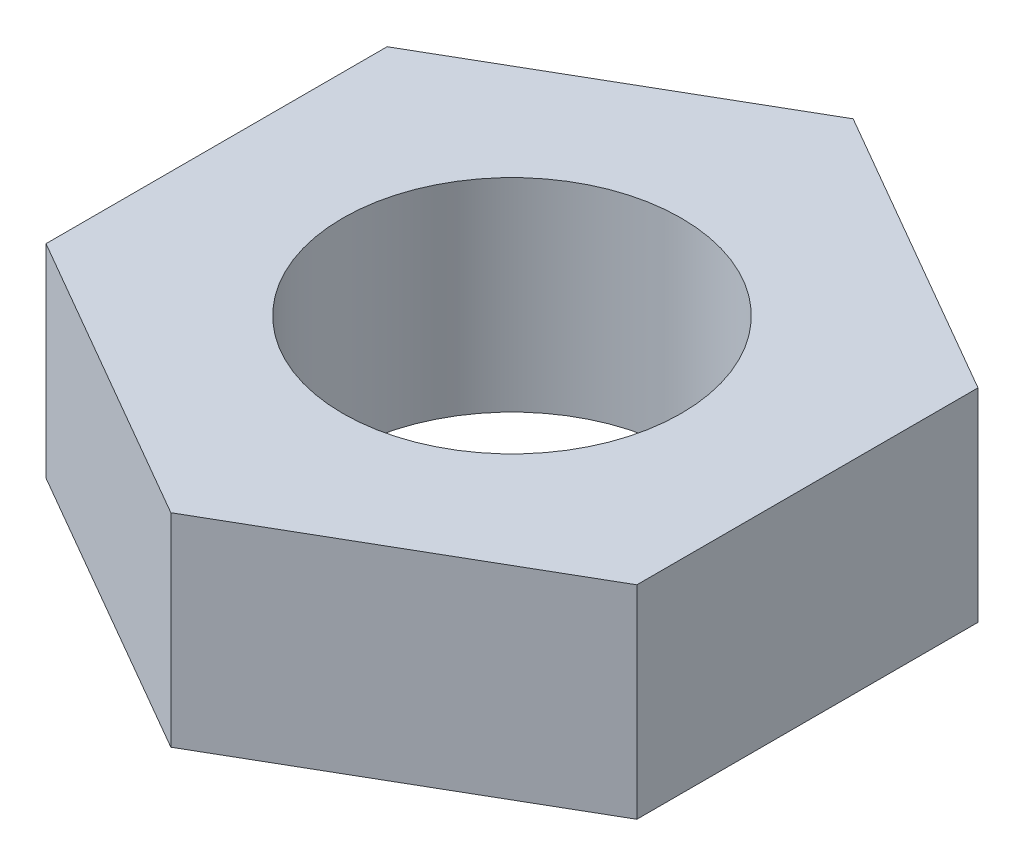
from build123d import *

# Parameters (mm, degrees)
SKETCH2_R           = 7.9375
BOSS_EXTRUDE1_DEPTH = 9.525


with BuildPart() as part:
    # Sketch2 → Boss-Extrude1 (new body)
    with BuildSketch(Plane(origin=(0, 0, 0), x_dir=(1, 0, 0), z_dir=(0, 1, 0))):
        Polygon((0, 16), (-13.856406461, 8), (-13.856406461, -8), (0, -16), (13.856406461, -8), (13.856406461, 8), align=None)
        with Locations(Location((0, 0, 0), (0, 0, 90))):
            Circle(SKETCH2_R, mode=Mode.SUBTRACT)
    extrude(amount=BOSS_EXTRUDE1_DEPTH)


solid = part.part
